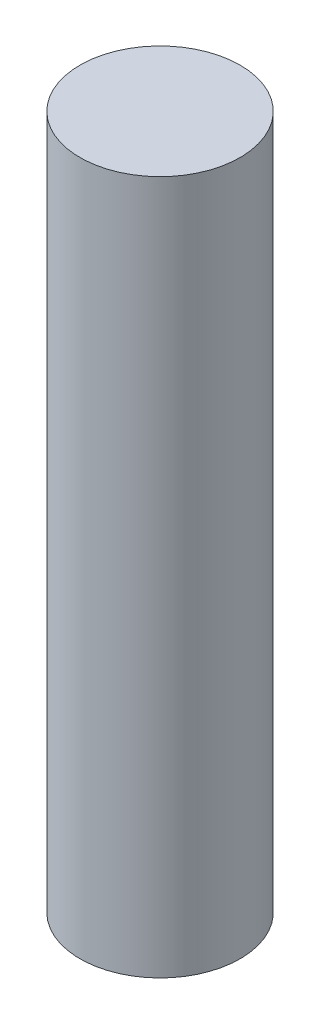
from build123d import *

# Parameters (mm, degrees)
SKETCH1_R           = 1.5
BOSS_EXTRUDE1_DEPTH = 13


with BuildPart() as part:
    # Sketch1 → Boss-Extrude1 (new body)
    with BuildSketch(Plane(origin=(0, 0, 0), x_dir=(1, 0, 0), z_dir=(0, 1, 0))):
        with Locations(Location((0, 0, 0), (0, 0, 90))):
            Circle(SKETCH1_R)
    extrude(amount=BOSS_EXTRUDE1_DEPTH)


solid = part.part
